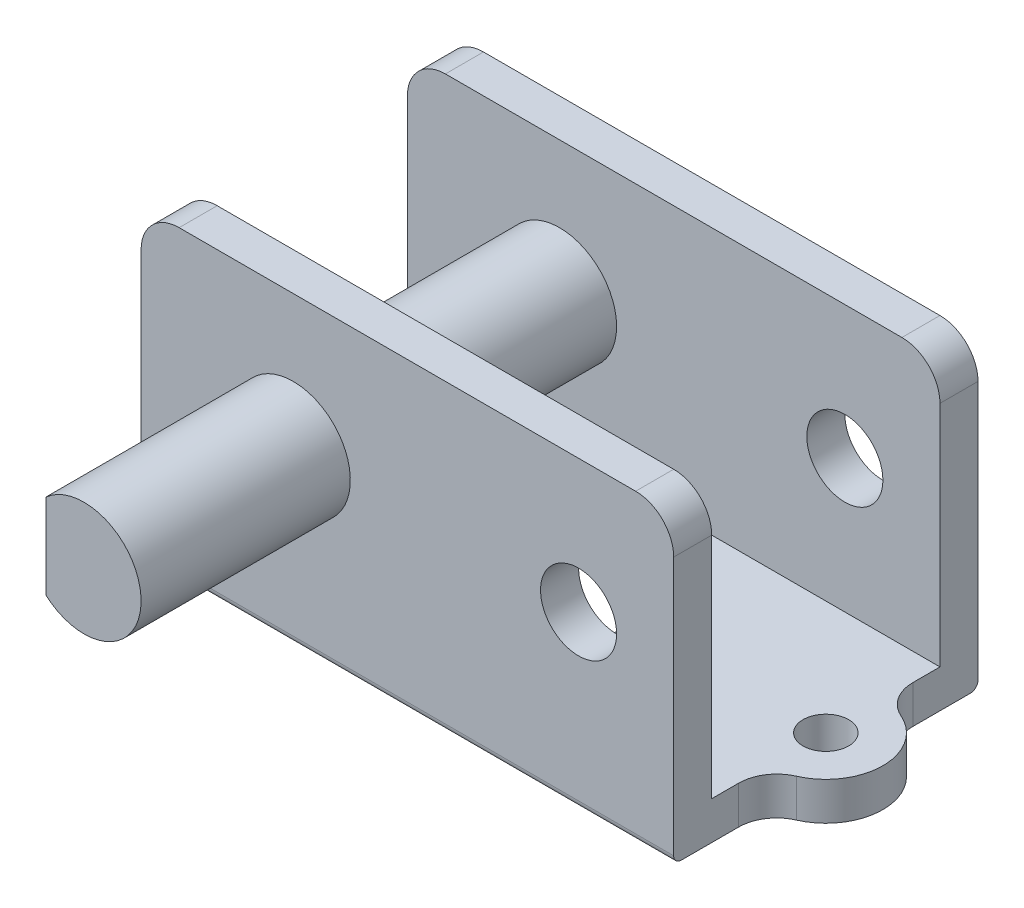
from build123d import *

# Parameters (mm, degrees)
EXTRUDE1_DEPTH      = 4
EXTRUDE2_DEPTH      = 12.357816692
EXTRUDE2_DEPTH_BACK = 12.357816692
SKETCH2_R           = 1
EXTRUDE3_DEPTH      = 12.357816692
EXTRUDE3_DEPTH_BACK = 12.357816692
SKETCH4_W           = 6
SKETCH4_H           = 8.732029078
FILLET1_R           = 0.2
FILLET2_R           = 1
EXTRUDE4_DEPTH      = 14
EXTRUDE4_DEPTH_BACK = 3
SKETCH3_R           = 1.5
EXTRUDE5_DEPTH      = 9
SKETCH6_R           = 1.5
EXTRUDE6_DEPTH      = 1
SKETCH7_R           = 0.6
EXTRUDE7_DEPTH      = 1
FILLET3_R           = 1
SKETCH8_R           = 2
EXTRUDE8_DEPTH      = 1
SKETCH9_W           = 5.922368331
SKETCH9_H           = 2.817570744
SKETCH9_H_2         = 4.117351233
EXTRUDE9_DEPTH      = 19.227726134


with BuildPart() as part:
    # Sketch1 → Extrude1 (new, symmetric)
    with BuildSketch(Plane.XY):
        Polygon((0, 0), (-7, 0), (-7, 8), (7, 8), (7, 0), align=None)
    extrude(amount=EXTRUDE1_DEPTH, both=True)

    # Sketch2 → Extrude2 (cut, two sides: drawn at the far end of the back side and taken through both)
    with BuildSketch(Plane.XY.offset(-EXTRUDE2_DEPTH_BACK)):
        with Locations((4.5, 4.5)):
            Circle(SKETCH2_R)
    extrude(amount=EXTRUDE2_DEPTH + EXTRUDE2_DEPTH_BACK, mode=Mode.SUBTRACT)

    # Sketch4 → Extrude3 (cut, two sides: drawn at the far end of the back side and taken through both)
    with BuildSketch(Plane(origin=(0, 0, 0), x_dir=(0, 0, -1), z_dir=(1, 0, 0)).offset(-EXTRUDE3_DEPTH_BACK)):
        with Locations((0, 5.366014539)):
            Rectangle(SKETCH4_W, SKETCH4_H)
    extrude(amount=EXTRUDE3_DEPTH + EXTRUDE3_DEPTH_BACK, mode=Mode.SUBTRACT)

    # Fillet1
    fillet1_edges = [part.edges().sort_by_distance(p)[0] for p in [
        (0, 0, 4),
        (0, 0, -4),
    ]]
    fillet(fillet1_edges, radius=FILLET1_R)

    # Fillet2
    fillet2_edges = [part.edges().sort_by_distance(p)[0] for p in [
        (-7, 8, -3.5),
        (7, 8, -3.5),
        (-7, 8, 3.5),
        (7, 8, 3.5),
    ]]
    fillet(fillet2_edges, radius=FILLET2_R)

    # Sketch3 → Extrude4 (add, two sides: drawn at the far end of the back side and taken through both)
    with BuildSketch(Plane.XY.offset(-EXTRUDE4_DEPTH_BACK)):
        with Locations((-3, 4.5)):
            Circle(SKETCH3_R)
    extrude(amount=EXTRUDE4_DEPTH + EXTRUDE4_DEPTH_BACK)

    # Sketch5 → Extrude5 (cut)
    with BuildSketch(Plane.XY.offset(14)):
        Polygon((-4, 4.5), (-4, 6.060686456), (-4.95644391, 6.060686456), (-4.95644391, 2.5), (-4, 2.5), align=None)
    extrude(amount=-EXTRUDE5_DEPTH, mode=Mode.SUBTRACT)

    # Sketch6 → Extrude6 (add)
    with BuildSketch(Plane.XZ):
        with Locations((-7, 0)):
            Circle(SKETCH6_R)
        with Locations((7, 0)):
            Circle(SKETCH6_R)
    extrude(amount=-EXTRUDE6_DEPTH)

    # Sketch7 → Extrude7 (cut)
    with BuildSketch(Plane.XZ):
        with Locations((-7, 0)):
            Circle(SKETCH7_R)
        with Locations((7, 0)):
            Circle(SKETCH7_R)
    extrude(amount=-EXTRUDE7_DEPTH, mode=Mode.SUBTRACT)

    # Fillet3
    fillet3_edges = [part.edges().sort_by_distance(p)[0] for p in [
        (7, 0.5, -1.5),
        (7, 0.5, 1.5),
        (-7, 0.5, 1.5),
        (-7, 0.5, -1.5),
    ]]
    fillet(fillet3_edges, radius=FILLET3_R)

    # Sketch8 → Extrude8 (cut)
    with BuildSketch(Plane.XZ):
        Circle(SKETCH8_R)
    extrude(amount=-EXTRUDE8_DEPTH, mode=Mode.SUBTRACT)

    # Sketch9 → Extrude9 (cut, through all)
    with BuildSketch(Plane(origin=(0, 0, 0), x_dir=(0, 0, -1), z_dir=(1, 0, 0))):
        with Locations((-12.461184166, 5.908785372)):
            Rectangle(SKETCH9_W, SKETCH9_H)
        with Locations((-12.461184166, 2.441324384)):
            Rectangle(SKETCH9_W, SKETCH9_H_2)
    extrude(amount=-EXTRUDE9_DEPTH, mode=Mode.SUBTRACT)


solid = part.part
